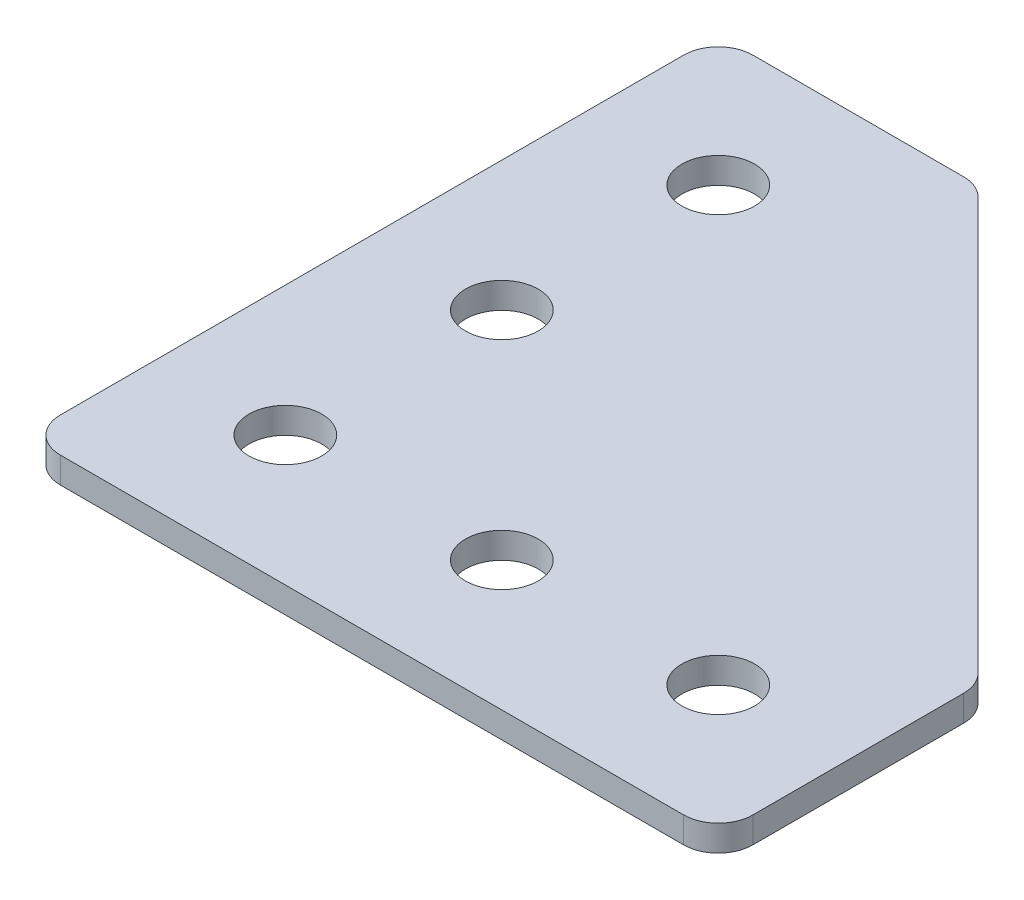
from build123d import *

# Parameters (mm, degrees)
SKETCH_2_R      = 2.1
EXTRUDE_1_DEPTH = 1.5
FILLET_1_R      = 2


with BuildPart() as part:
    # ｽｹｯﾁ2 → ﾎﾞｽ - 押し出し1 (new body)
    with BuildSketch(Plane(origin=(0, 0, 0), x_dir=(1, 0, 0), z_dir=(0, 1, 0))):
        Polygon((0, 0), (40, 0), (40, 15), (15, 40), (0, 40), align=None)
        with Locations(Location((7.5, 7.5, 0), (0, 0, 270))):
            Circle(SKETCH_2_R, mode=Mode.SUBTRACT)
        with Locations(Location((32.5, 7.5, 0), (0, 0, 270))):
            Circle(SKETCH_2_R, mode=Mode.SUBTRACT)
        with Locations(Location((7.5, 32.5, 0), (0, 0, 90))):
            Circle(SKETCH_2_R, mode=Mode.SUBTRACT)
        with Locations(Location((20, 7.5, 0), (0, 0, 270))):
            Circle(SKETCH_2_R, mode=Mode.SUBTRACT)
        with Locations(Location((7.5, 20, 0), (0, 0, 270))):
            Circle(SKETCH_2_R, mode=Mode.SUBTRACT)
    extrude(amount=EXTRUDE_1_DEPTH)

    # ﾌｨﾚｯﾄ1
    fillet_1_edges = [part.edges().sort_by_distance(p)[0] for p in [
        (0, 0.75, -40),
        (15, 0.75, -40),
        (40, 0.75, -15),
        (40, 0.75, 0),
        (0, 0.75, 0),
    ]]
    fillet(fillet_1_edges, radius=FILLET_1_R)


solid = part.part
